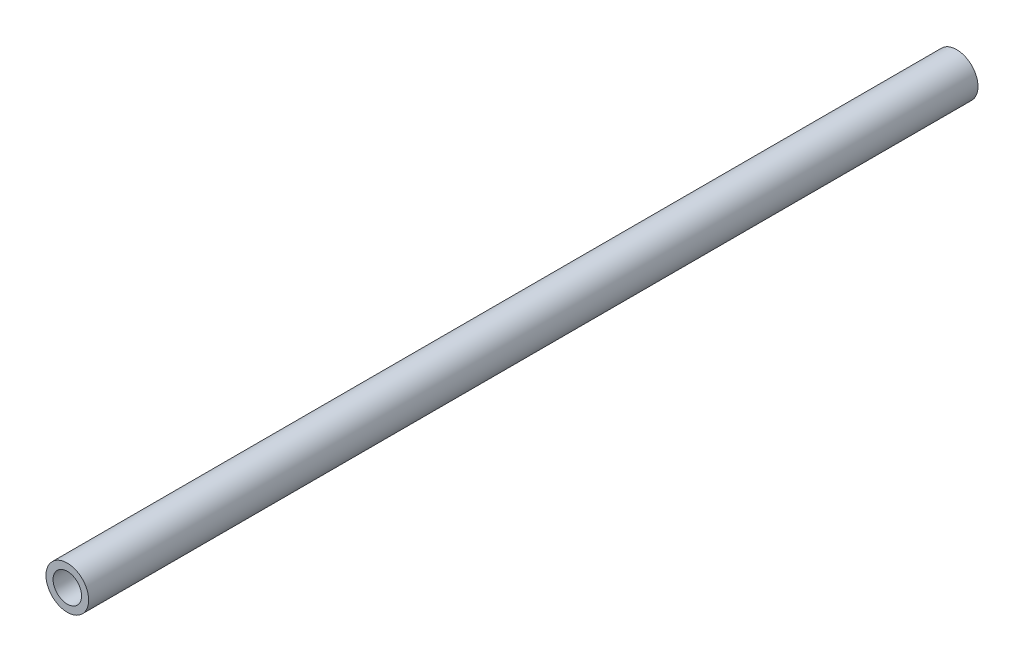
from build123d import *

# Parameters (mm, degrees)
SKETCH_1_R      = 3
SKETCH_1_R_2    = 2
EXTRUDE_1_DEPTH = 125


with BuildPart() as part:
    # 草图1 → 凸台-拉伸1 (new body)
    with BuildSketch(Plane.XY):
        Circle(SKETCH_1_R)
        Circle(SKETCH_1_R_2, mode=Mode.SUBTRACT)
    extrude(amount=EXTRUDE_1_DEPTH)


solid = part.part
